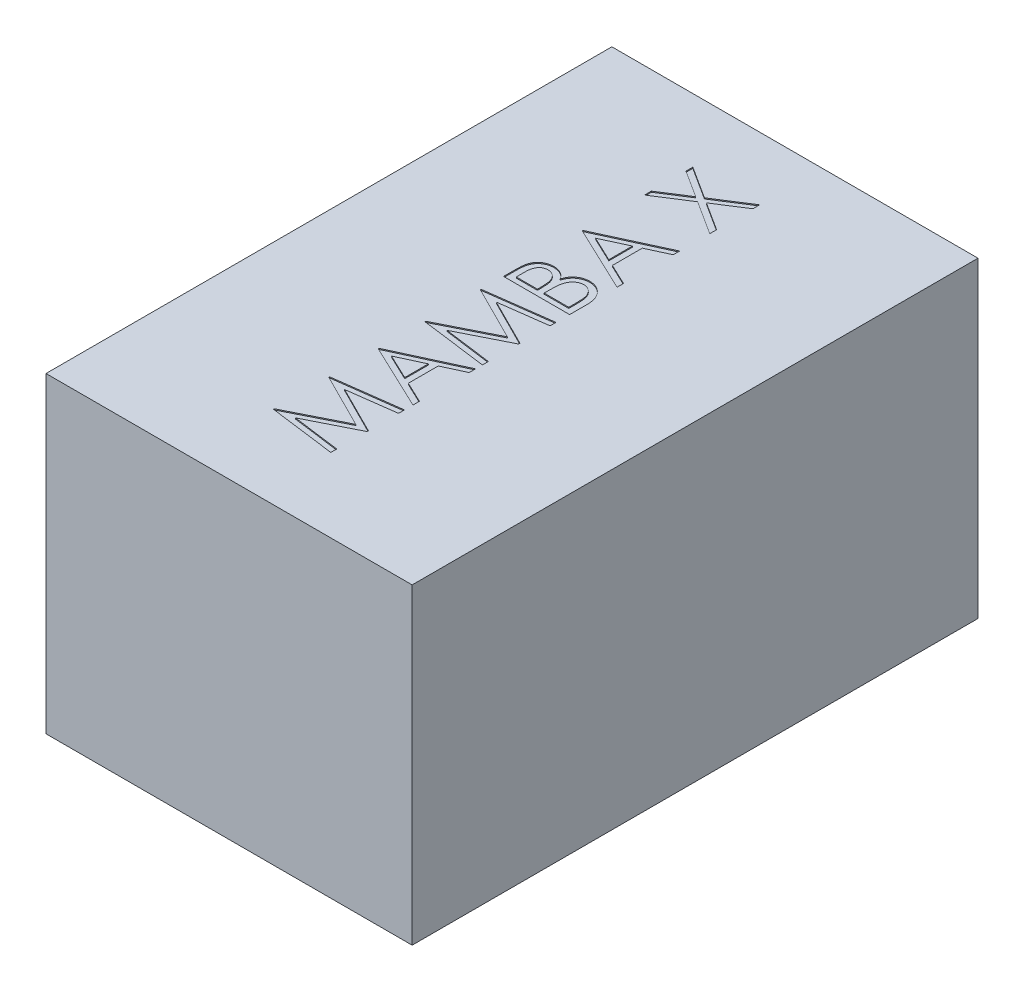
from build123d import *

# Parameters (mm, degrees)
SKETCH1_W           = 35.2
SKETCH1_H           = 54.4
BOSS_EXTRUDE1_DEPTH = 30
CUT_EXTRUDE1_DEPTH  = 0.1


with BuildPart() as part:
    # Sketch1 → Boss-Extrude1 (new body)
    with BuildSketch(Plane(origin=(0, 0, 0), x_dir=(1, 0, 0), z_dir=(0, 1, 0))):
        Rectangle(SKETCH1_W, SKETCH1_H)
    extrude(amount=BOSS_EXTRUDE1_DEPTH)

    # Sketch2 → Cut-Extrude1 (cut)
    # profile 1 of 6: a face of its own
    with BuildSketch(Plane(origin=(0, 30, 0), x_dir=(1, 0, 0), z_dir=(0, 1, 0))):
        Polygon((2.663738641, -20.083303144), (-3.686261359, -19.24503191), (-3.686261359, -19.163621654), (1.523995051, -16.54195699), (-3.686261359, -13.926652503), (-3.686261359, -13.843970211), (2.663738641, -13.000610836), (2.663738641, -13.573026702), (-1.905412, -14.181059554), (2.663738641, -16.473267086), (2.663738641, -16.601742647), (-1.915588282, -18.902854426), (2.663738641, -19.509615243), align=None)
    # profile 2 of 6: a face of its own
    with BuildSketch(Plane(origin=(0, 30, 0), x_dir=(1, 0, 0), z_dir=(0, 1, 0))):
        Polygon((-3.686261359, -9.092918529), (2.663738641, -6.162149298), (2.663738641, -6.781630468), (0.62848223, -7.720392487), (0.62848223, -10.599008272), (2.663738641, -11.564483032), (2.663738641, -12.186508272), (-3.686261359, -9.174328785), align=None)
        Polygon((-2.448571055, -9.139983833), (-0.022799821, -10.289903705), (-0.022799821, -8.020592808), align=None, mode=Mode.SUBTRACT)
    # profile 3 of 6: a face of its own
    with BuildSketch(Plane(origin=(0, 30, 0), x_dir=(1, 0, 0), z_dir=(0, 1, 0))):
        Polygon((2.663738641, -5.510867247), (-3.686261359, -4.672596013), (-3.686261359, -4.591185756), (1.523995051, -1.969521093), (-3.686261359, 0.645783394), (-3.686261359, 0.728465686), (2.663738641, 1.571825061), (2.663738641, 0.999409196), (-1.905412, 0.391376343), (2.663738641, -1.900831189), (2.663738641, -2.02930675), (-1.915588282, -4.330418529), (2.663738641, -4.937179346), align=None)
    # profile 4 of 6: a face of its own
    with BuildSketch(Plane(origin=(0, 30, 0), x_dir=(1, 0, 0), z_dir=(0, 1, 0))):
        with BuildLine():
            Line((-3.686261359, 2.874389164), (-3.686261359, 4.113351503))
            add(Edge.make_bspline(
                [(-3.686261359, 4.113351503), (-3.685947518, 4.17400127), (-3.685339215, 4.291555613), (-3.675685885, 4.462483602), (-3.662852695, 4.622637187), (-3.641325711, 4.771733359), (-3.619005068, 4.910742263), (-3.586243707, 5.038252668), (-3.55005759, 5.15533263), (-3.494380339, 5.295921701), (-3.407912866, 5.455439265), (-3.279673387, 5.626890799), (-3.125924606, 5.775926934), (-2.950715744, 5.902651825), (-2.75796614, 6.004351247), (-2.551822866, 6.076995491), (-2.335754034, 6.12366492), (-2.187618873, 6.128404243), (-2.112753747, 6.13079942)],
                knots=[0, 0, 0, 0, 1.00128172, 1.940733171, 2.826250472, 3.653024905, 4.427672124, 5.149348099, 5.824709082, 6.450061444, 7.643590664, 8.808605388, 9.972104426, 11.165284501, 12.367876273, 13.557044126, 14.765369432, 16, 16, 16, 16], degree=3))
            add(Edge.make_bspline(
                [(-2.112753747, 6.13079942), (-2.042630051, 6.128804412), (-1.904830375, 6.124884033), (-1.703630007, 6.087852701), (-1.512300219, 6.029078685), (-1.33100476, 5.947850624), (-1.163118461, 5.843192811), (-1.009161388, 5.717798041), (-0.874952272, 5.567137227), (-0.79995004, 5.454201374), (-0.761852305, 5.396835077)],
                knots=[0, 0, 0, 0, 1.044641374, 2.052818814, 3.038628718, 4.023282556, 5.005660861, 5.98021751, 6.974042014, 8, 8, 8, 8], degree=3))
            add(Edge.make_bspline(
                [(-0.761852305, 5.396835077), (-0.734148267, 5.468964887), (-0.681143581, 5.606967082), (-0.587578442, 5.796987788), (-0.485443149, 5.960105657), (-0.375629467, 6.099507114), (-0.255516262, 6.218101669), (-0.124127669, 6.320811412), (0.018428749, 6.409605986), (0.171629053, 6.485169554), (0.334174493, 6.544525679), (0.504079737, 6.588151608), (0.680693455, 6.613957294), (0.80054706, 6.617477585), (0.861264682, 6.619260959)],
                knots=[0, 0, 0, 0, 1.272586185, 2.434772614, 3.483318042, 4.437947805, 5.351807173, 6.25737843, 7.180033415, 8.1141739, 9.066731021, 10.025721652, 10.999834114, 12, 12, 12, 12], degree=3))
            add(Edge.make_bspline(
                [(0.861264682, 6.619260959), (0.923253403, 6.617489068), (1.045217946, 6.614002824), (1.224384373, 6.588270771), (1.395620732, 6.544731726), (1.559955701, 6.484656401), (1.717044728, 6.40678878), (1.86631873, 6.310656843), (2.008088271, 6.19761009), (2.142603557, 6.069848985), (2.265689272, 5.92746923), (2.371501477, 5.770557575), (2.462484894, 5.603412637), (2.536560348, 5.423897625), (2.593709512, 5.232470806), (2.633526759, 5.029238698), (2.660400578, 4.814535995), (2.662607073, 4.667197225), (2.663738641, 4.59163676)],
                knots=[0, 0, 0, 0, 0.978680899, 1.925582087, 2.851223405, 3.764209995, 4.683484765, 5.614004905, 6.562443559, 7.542772147, 8.539900013, 9.527881485, 10.525548727, 11.540192123, 12.58875426, 13.674701727, 14.807505862, 16, 16, 16, 16], degree=3))
            Line((2.663738641, 4.59163676), (2.663738641, 2.874389164))
            Line((2.663738641, 2.874389164), (-3.686261359, 2.874389164))
        make_face()
        with BuildLine():
            Line((-3.034979308, 3.444260959), (-0.999722898, 3.444260959))
            Line((-0.999722898, 3.444260959), (-0.999722898, 3.827143571))
            add(Edge.make_bspline(
                [(-0.999722898, 3.827143571), (-1.000448472, 3.8831121), (-1.00185043, 3.991254703), (-1.005866384, 4.147863657), (-1.017111401, 4.293233338), (-1.028353206, 4.427112788), (-1.046631335, 4.549291282), (-1.068388642, 4.659497805), (-1.091398506, 4.759463042), (-1.130534038, 4.874739232), (-1.188353511, 5.005518464), (-1.278171729, 5.144843329), (-1.385066749, 5.268239823), (-1.509562523, 5.371191651), (-1.645160313, 5.456193757), (-1.790669697, 5.515740405), (-1.943162486, 5.555438382), (-2.048051128, 5.559079134), (-2.10130543, 5.560927625)],
                knots=[0, 0, 0, 0, 1.156917035, 2.235399477, 3.236897345, 4.169954739, 5.01148057, 5.788325709, 6.491867502, 7.129259015, 8.302032419, 9.437271567, 10.542795419, 11.662606952, 12.764338259, 13.836858145, 14.901724648, 16, 16, 16, 16], degree=3))
            add(Edge.make_bspline(
                [(-2.10130543, 5.560927625), (-2.13655395, 5.559989075), (-2.205697771, 5.558148007), (-2.306820964, 5.542521884), (-2.401839674, 5.517203418), (-2.491665842, 5.48291539), (-2.574067073, 5.436072855), (-2.65298071, 5.381776203), (-2.723680212, 5.314739278), (-2.789569329, 5.2389816), (-2.848539868, 5.152301304), (-2.897387819, 5.052830862), (-2.941660294, 4.943141736), (-2.97443389, 4.820258001), (-3.00325313, 4.686725849), (-3.021360451, 4.540737206), (-3.033012685, 4.38321717), (-3.034309145, 4.27407557), (-3.034979308, 4.217658394)],
                knots=[0, 0, 0, 0, 0.911708768, 1.788416306, 2.640049961, 3.452993646, 4.268229297, 5.087074648, 5.92553149, 6.781184137, 7.681934069, 8.628939405, 9.643570426, 10.73771997, 11.914765019, 13.176320755, 14.540391495, 16, 16, 16, 16], degree=3))
            Line((-3.034979308, 4.217658394), (-3.034979308, 3.444260959))
        make_face(mode=Mode.SUBTRACT)
        with BuildLine():
            Line((-0.348440847, 3.444260959), (2.012456589, 3.444260959))
            Line((2.012456589, 3.444260959), (2.012456589, 4.255819452))
            add(Edge.make_bspline(
                [(2.012456589, 4.255819452), (2.011691133, 4.313904856), (2.010215818, 4.425856815), (2.006755897, 4.587623502), (1.993667542, 4.737164959), (1.981593593, 4.874952938), (1.960947659, 5.000621747), (1.941463265, 5.115138039), (1.912540074, 5.21662195), (1.872788551, 5.335381604), (1.809151298, 5.468127448), (1.716177872, 5.613194762), (1.601434311, 5.739691211), (1.470935241, 5.848276604), (1.329434427, 5.937885986), (1.17878172, 6.002189193), (1.02190703, 6.0421495), (0.914919928, 6.046971084), (0.861264682, 6.049389164)],
                knots=[0, 0, 0, 0, 1.160376723, 2.23647316, 3.230273494, 4.158083346, 4.997711197, 5.773399541, 6.476071462, 7.102777513, 8.27340052, 9.405620712, 10.53304798, 11.669441455, 12.787990954, 13.865552736, 14.929550474, 16, 16, 16, 16], degree=3))
            add(Edge.make_bspline(
                [(0.861264682, 6.049389164), (0.827711756, 6.048889766), (0.761147116, 6.047899025), (0.66333895, 6.032889544), (0.568547371, 6.011175582), (0.476377366, 5.982577669), (0.388378653, 5.942599328), (0.304213755, 5.893589233), (0.222187198, 5.837488471), (0.117145087, 5.750935608), (-0.002378264, 5.623205662), (-0.117953532, 5.441687154), (-0.212666344, 5.236433762), (-0.252706867, 5.087217582), (-0.273390766, 5.010136359)],
                knots=[0, 0, 0, 0, 0.723302347, 1.434937762, 2.129609326, 2.821140842, 3.513216847, 4.209993937, 4.920569932, 5.655069131, 7.14393391, 8.6716197, 10.280644748, 12, 12, 12, 12], degree=3))
            add(Edge.make_bspline(
                [(-0.273390766, 5.010136359), (-0.279659276, 4.979240714), (-0.293250697, 4.912252582), (-0.307597531, 4.803018829), (-0.320379282, 4.678312324), (-0.329833811, 4.537845104), (-0.33960654, 4.381439449), (-0.343407144, 4.208761325), (-0.347941516, 4.020515912), (-0.348270145, 3.889901179), (-0.348440847, 3.82205543)],
                knots=[0, 0, 0, 0, 0.634451884, 1.375622551, 2.216452059, 3.157844607, 4.20941857, 5.370758133, 6.634282058, 8, 8, 8, 8], degree=3))
            Line((-0.348440847, 3.82205543), (-0.348440847, 3.444260959))
        make_face(mode=Mode.SUBTRACT)
    # profile 5 of 6: a face of its own
    with BuildSketch(Plane(origin=(0, 30, 0), x_dir=(1, 0, 0), z_dir=(0, 1, 0))):
        Polygon((-3.686261359, 10.526953266), (2.663738641, 13.457722497), (2.663738641, 12.838241327), (0.62848223, 11.899479308), (0.62848223, 9.020863523), (2.663738641, 8.055388763), (2.663738641, 7.433363523), (-3.686261359, 10.44554301), align=None)
        Polygon((-2.448571055, 10.479887962), (-0.022799821, 9.32996809), (-0.022799821, 11.599278987), align=None, mode=Mode.SUBTRACT)
    # profile 6 of 6: a face of its own
    with BuildSketch(Plane(origin=(0, 30, 0), x_dir=(1, 0, 0), z_dir=(0, 1, 0))):
        Polygon((-3.686261359, 16.429196856), (-3.686261359, 17.086839084), (-1.088765366, 18.749389164), (-3.686261359, 20.411939244), (-3.686261359, 21.069581471), (-0.574863122, 19.078846295), (2.663738641, 21.150991728), (2.663738641, 20.4933495), (-0.060960879, 18.749389164), (2.663738641, 17.005428827), (2.663738641, 16.3477866), (-0.574863122, 18.421204067), align=None)
    extrude(amount=-CUT_EXTRUDE1_DEPTH, mode=Mode.SUBTRACT)


solid = part.part
